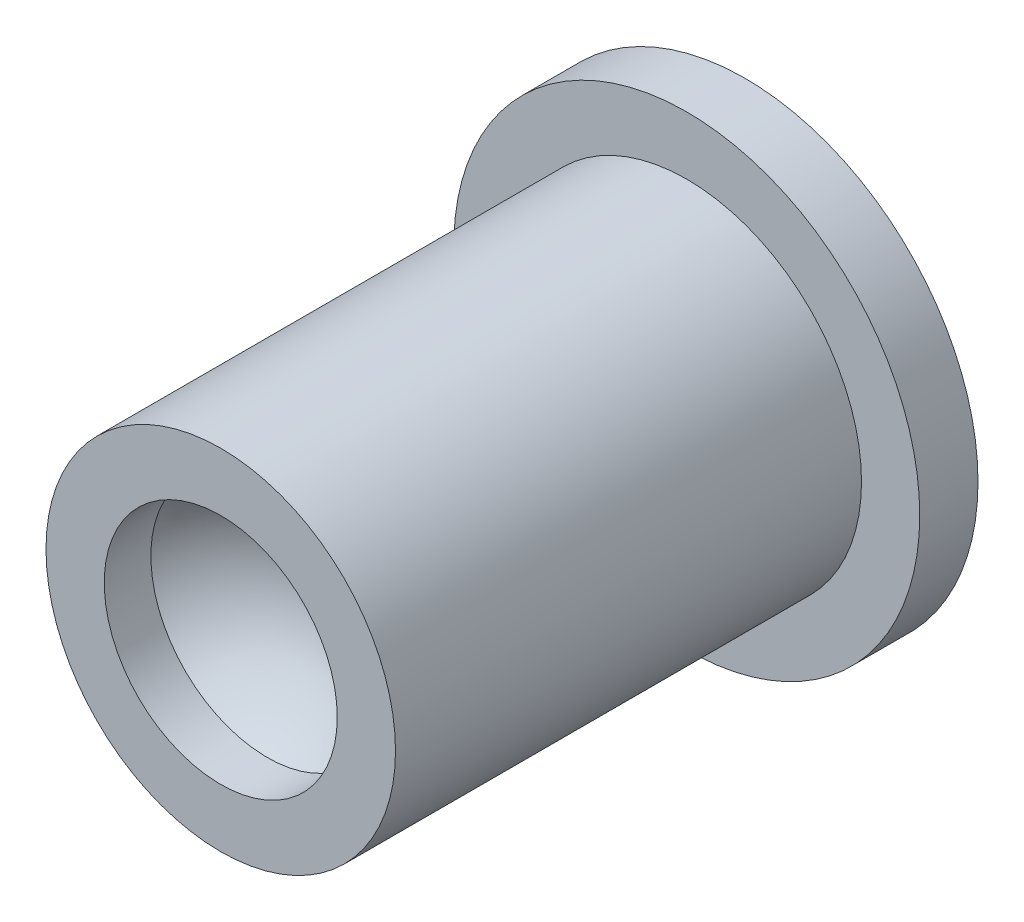
from build123d import *

# Parameters (mm, degrees)
SKETCH2_R           = 4
BOSS_EXTRUDE1_DEPTH = 1
SKETCH3_R           = 3
BOSS_EXTRUDE2_DEPTH = 8
SKETCH4_R           = 2
CUT_EXTRUDE4_DEPTH  = 0.8
DOME2_FACE_RADIUS   = 2
DOME2_HEIGHT        = 1


with BuildPart() as part:
    # Sketch2 → Boss-Extrude1 (new body)
    with BuildSketch(Plane.XY):
        Circle(SKETCH2_R)
    extrude(amount=BOSS_EXTRUDE1_DEPTH)

    # Sketch3 → Boss-Extrude2 (add)
    with BuildSketch(Plane.XY.offset(1)):
        Circle(SKETCH3_R)
    extrude(amount=BOSS_EXTRUDE2_DEPTH)

    # Sketch4 → Cut-Extrude4 (cut)
    with BuildSketch(Plane.XY.offset(9)):
        Circle(SKETCH4_R)
    extrude(amount=-CUT_EXTRUDE4_DEPTH, mode=Mode.SUBTRACT)

    # Dome2: a dome of height H over a round flat face of radius A is a cap of a sphere of radius (A * A + H * H) / (2 * H)
    dome2_r = (DOME2_FACE_RADIUS * DOME2_FACE_RADIUS + DOME2_HEIGHT * DOME2_HEIGHT) / (2 * DOME2_HEIGHT)
    dome2_base = Plane((0, 0, 8.2), z_dir=(0, 0, -1))
    with Locations(dome2_base.offset(DOME2_HEIGHT - dome2_r)):
        dome2_ball = Sphere(dome2_r, mode=Mode.PRIVATE)
    add(split(dome2_ball, bisect_by=dome2_base, keep=Keep.TOP, mode=Mode.PRIVATE), mode=Mode.SUBTRACT)


solid = part.part
